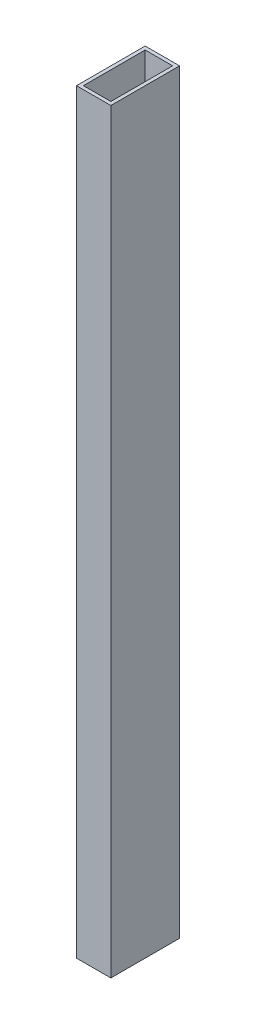
from build123d import *

# Parameters (mm, degrees)
SKETCH1_W           = 25.4
SKETCH1_H           = 50.8
BOSS_EXTRUDE2_DEPTH = 558.8
SKETCH2_W           = 20.32
SKETCH2_H           = 45.72
CUT_EXTRUDE1_DEPTH  = 558.8


with BuildPart() as part:
    # Sketch1 → Boss-Extrude2 (new body)
    with BuildSketch(Plane(origin=(0, 0, 0), x_dir=(1, 0, 0), z_dir=(0, 1, 0))):
        with Locations((12.7, 25.4)):
            Rectangle(SKETCH1_W, SKETCH1_H)
    extrude(amount=BOSS_EXTRUDE2_DEPTH)

    # Sketch2 → Cut-Extrude1 (cut)
    with BuildSketch(Plane(origin=(0, 558.8, 0), x_dir=(1, 0, 0), z_dir=(0, 1, 0))):
        with Locations((12.7, 25.4)):
            Rectangle(SKETCH2_W, SKETCH2_H)
    extrude(amount=-CUT_EXTRUDE1_DEPTH, mode=Mode.SUBTRACT)


solid = part.part
